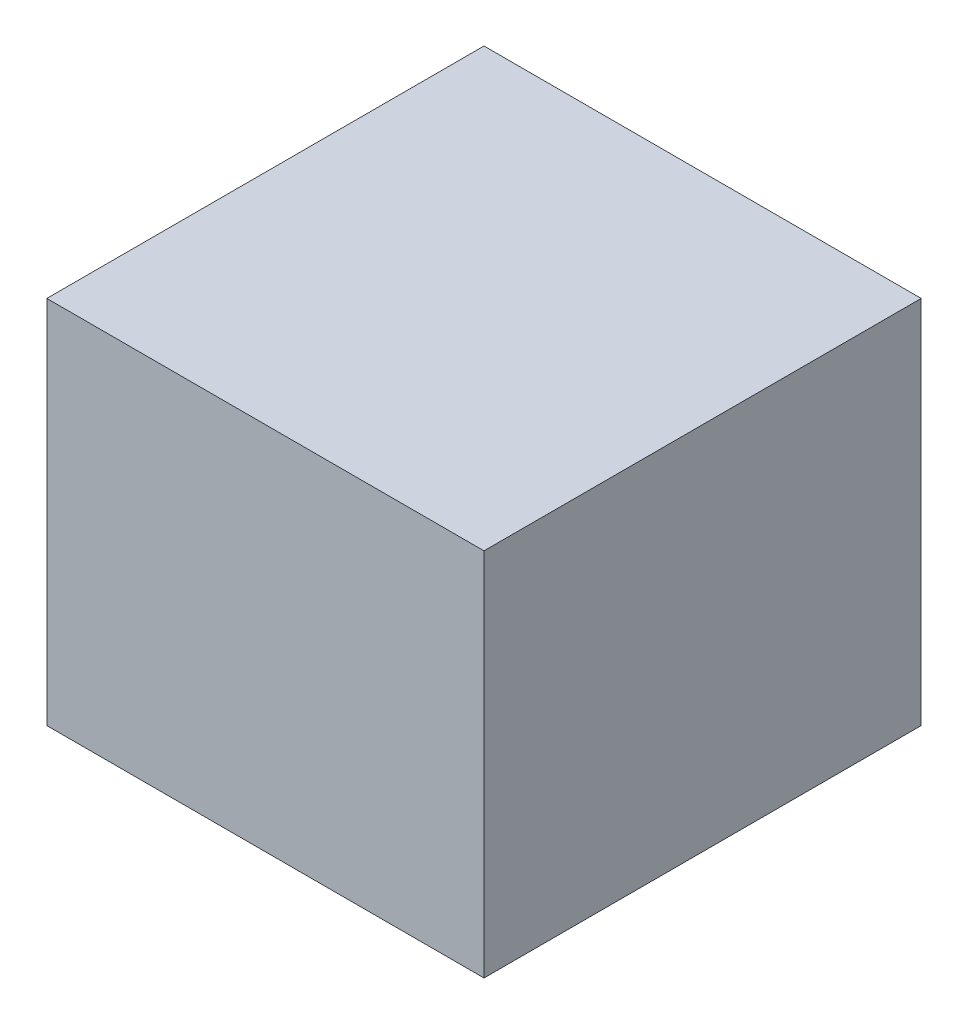
from build123d import *

# Parameters (mm, degrees)
SKETCH1_W           = 330.2
SKETCH1_H           = 279.4
BOSS_EXTRUDE1_DEPTH = 165.1


with BuildPart() as part:
    # Sketch1 → Boss-Extrude1 (new, symmetric)
    with BuildSketch(Plane(origin=(0, 0, 0), x_dir=(0, 0, -1), z_dir=(1, 0, 0))):
        Rectangle(SKETCH1_W, SKETCH1_H)
    extrude(amount=BOSS_EXTRUDE1_DEPTH, both=True)


solid = part.part
